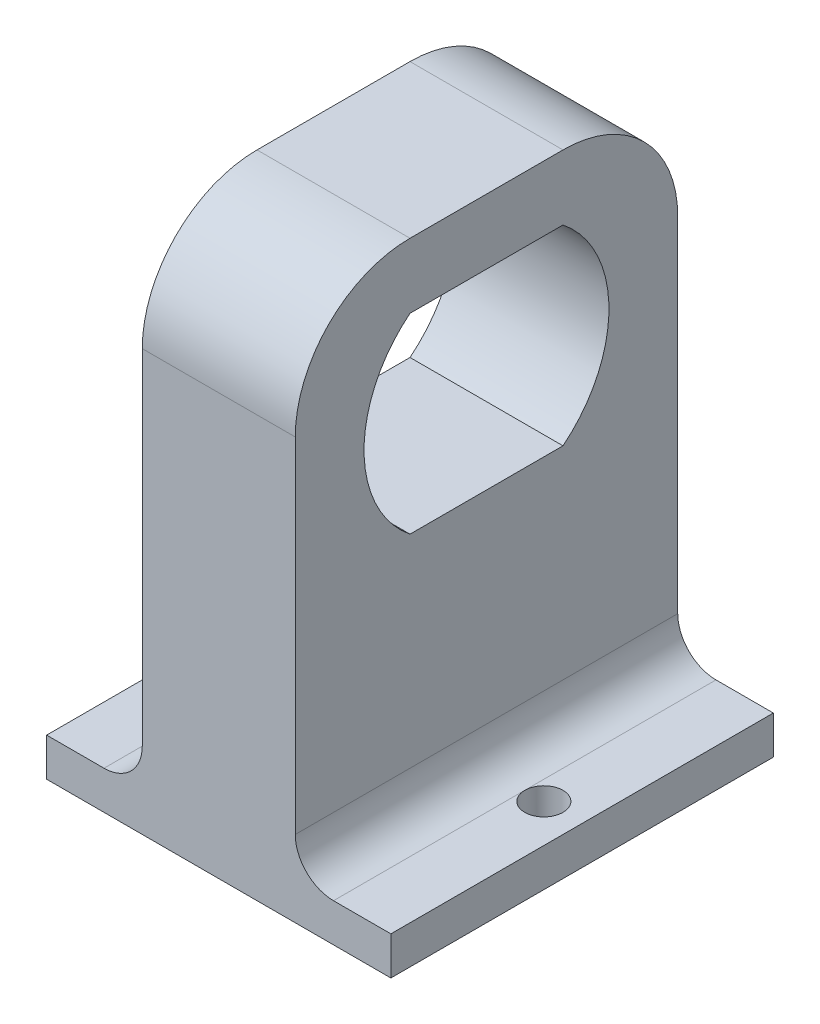
from build123d import *

# Parameters (mm, degrees)
SKETCH1_W           = 63.5
SKETCH1_H           = 88.9
BOSS_EXTRUDE1_DEPTH = 12.7
SKETCH2_W           = 63.5
SKETCH2_H           = 6.35
BOSS_EXTRUDE2_DEPTH = 28.575
FILLET1_R           = 6.35
SKETCH3_R           = 3.175
CUT_EXTRUDE1_DEPTH  = 93.946735419
FILLET2_R           = 19.05


with BuildPart() as part:
    # Sketch1 → Boss-Extrude1 (new, symmetric)
    with BuildSketch(Plane(origin=(0, 0, 0), x_dir=(0, 0, -1), z_dir=(1, 0, 0))):
        Rectangle(SKETCH1_W, SKETCH1_H)
        with BuildLine():
            Line((-12.7, 1.905), (12.7, 1.905))
            ThreePointArc((12.7, 1.905), (20.329919454, 17.78), (12.7, 33.655))
            Line((12.7, 33.655), (-12.7, 33.655))
            ThreePointArc((-12.7, 33.655), (-20.329919454, 17.78), (-12.7, 1.905))
        make_face(mode=Mode.SUBTRACT)
    extrude(amount=BOSS_EXTRUDE1_DEPTH, both=True)

    # Sketch2 → Boss-Extrude2 (add, symmetric)
    with BuildSketch(Plane(origin=(0, 0, 0), x_dir=(0, 0, -1), z_dir=(1, 0, 0))):
        with Locations((0, -41.275)):
            Rectangle(SKETCH2_W, SKETCH2_H)
    extrude(amount=BOSS_EXTRUDE2_DEPTH, both=True)

    # Fillet1
    fillet1_edges = [part.edges().sort_by_distance(p)[0] for p in [
        (12.7, -38.1, 0),
        (-12.7, -38.1, 0),
    ]]
    fillet(fillet1_edges, radius=FILLET1_R)

    # Sketch3 → Cut-Extrude1 (cut, through all)
    with BuildSketch(Plane(origin=(0, -38.1, 0), x_dir=(1, 0, 0), z_dir=(0, 1, 0))):
        with Locations(Location((22.225, 0, 0), (0, 0, 270))):
            Circle(SKETCH3_R)
    cut_extrude1 = extrude(amount=-CUT_EXTRUDE1_DEPTH, mode=Mode.SUBTRACT)

    # Mirror1: Cut-Extrude1 across plane
    add(cut_extrude1.mirror(Plane(origin=(0, 0, 0), x_dir=(0, 0, 1), z_dir=(1, 0, 0))), mode=Mode.SUBTRACT)

    # Fillet2
    fillet2_edges = [part.edges().sort_by_distance(p)[0] for p in [
        (0, 44.45, 31.75),
        (0, 44.45, -31.75),
    ]]
    fillet(fillet2_edges, radius=FILLET2_R)


solid = part.part
